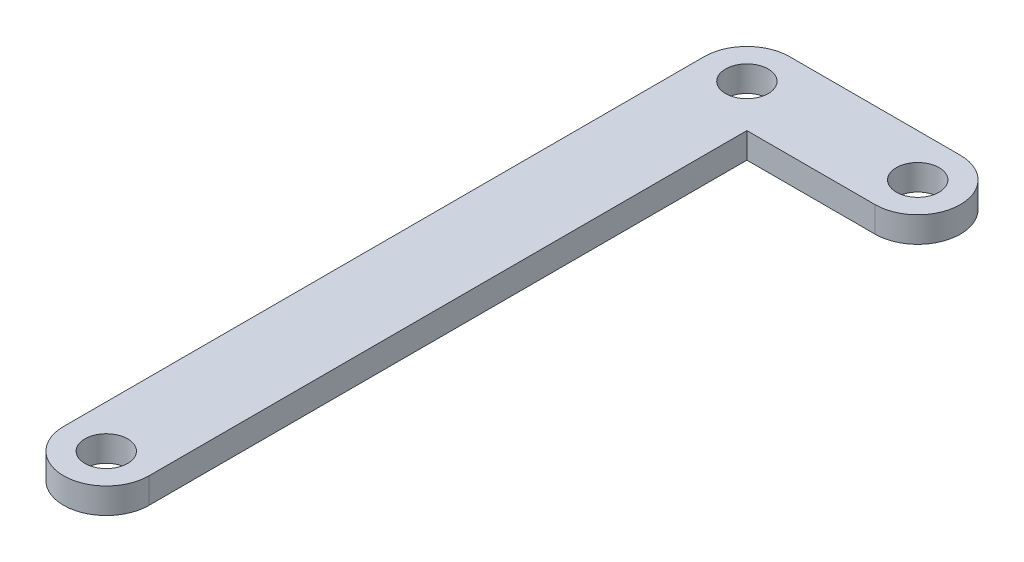
from build123d import *

# Parameters (mm, degrees)
SKETCH1_R           = 2.5
BOSS_EXTRUDE1_DEPTH = 3


with BuildPart() as part:
    # Sketch1 → Boss-Extrude1 (new body)
    # profile 1 of 4: a face of its own
    with BuildSketch(Plane(origin=(0, 0, 0), x_dir=(1, 0, 0), z_dir=(0, 1, 0))):
        with BuildLine():
            Line((19.068769591, 26.574235382), (19.068769591, -48.425764618))
            ThreePointArc((19.068769591, -48.425764618), (24.068769591, -53.425764618), (29.068769591, -48.425764618))
            Line((29.068769591, -48.425764618), (29.068769591, 21.574235382))
            Line((29.068769591, 21.574235382), (24.068769591, 21.574235382))
            Line((24.068769591, 21.574235382), (24.068769591, 24.074235382))
            ThreePointArc((24.068769591, 24.074235382), (22.301002638, 24.806468429), (21.568769591, 26.574235382))
            Line((21.568769591, 26.574235382), (19.068769591, 26.574235382))
        make_face()
        with Locations(Location((24.068769591, -48.425764618, 0), (0, 0, 270))):
            Circle(SKETCH1_R, mode=Mode.SUBTRACT)
    # profile 2 of 4: a face of its own
    with BuildSketch(Plane(origin=(0, 0, 0), x_dir=(1, 0, 0), z_dir=(0, 1, 0))):
        with BuildLine():
            Line((44.068769591, 31.574235382), (24.068769591, 31.574235382))
            Line((24.068769591, 31.574235382), (24.068769591, 29.074235382))
            ThreePointArc((24.068769591, 29.074235382), (25.836536544, 28.342002335), (26.568769591, 26.574235382))
            Line((26.568769591, 26.574235382), (29.068769591, 26.574235382))
            Line((29.068769591, 26.574235382), (29.068769591, 21.574235382))
            Line((29.068769591, 21.574235382), (44.068769591, 21.574235382))
            ThreePointArc((44.068769591, 21.574235382), (49.068769591, 26.574235382), (44.068769591, 31.574235382))
        make_face()
        with Locations(Location((44.068769591, 26.574235382, 0), (0, 0, 270))):
            Circle(SKETCH1_R, mode=Mode.SUBTRACT)
    # profile 3 of 4: a face of its own
    with BuildSketch(Plane(origin=(0, 0, 0), x_dir=(1, 0, 0), z_dir=(0, 1, 0))):
        with BuildLine():
            Line((24.068769591, 21.574235382), (29.068769591, 21.574235382))
            Line((29.068769591, 21.574235382), (29.068769591, 26.574235382))
            Line((29.068769591, 26.574235382), (26.568769591, 26.574235382))
            ThreePointArc((26.568769591, 26.574235382), (25.836536544, 24.806468429), (24.068769591, 24.074235382))
            Line((24.068769591, 24.074235382), (24.068769591, 21.574235382))
        make_face()
    # profile 4 of 4: a face of its own
    with BuildSketch(Plane(origin=(0, 0, 0), x_dir=(1, 0, 0), z_dir=(0, 1, 0))):
        with BuildLine():
            ThreePointArc((24.068769591, 31.574235382), (20.533235685, 30.109769288), (19.068769591, 26.574235382))
            Line((19.068769591, 26.574235382), (21.568769591, 26.574235382))
            ThreePointArc((21.568769591, 26.574235382), (22.301002638, 28.342002335), (24.068769591, 29.074235382))
            Line((24.068769591, 29.074235382), (24.068769591, 31.574235382))
        make_face()
    extrude(amount=BOSS_EXTRUDE1_DEPTH)


solid = part.part
